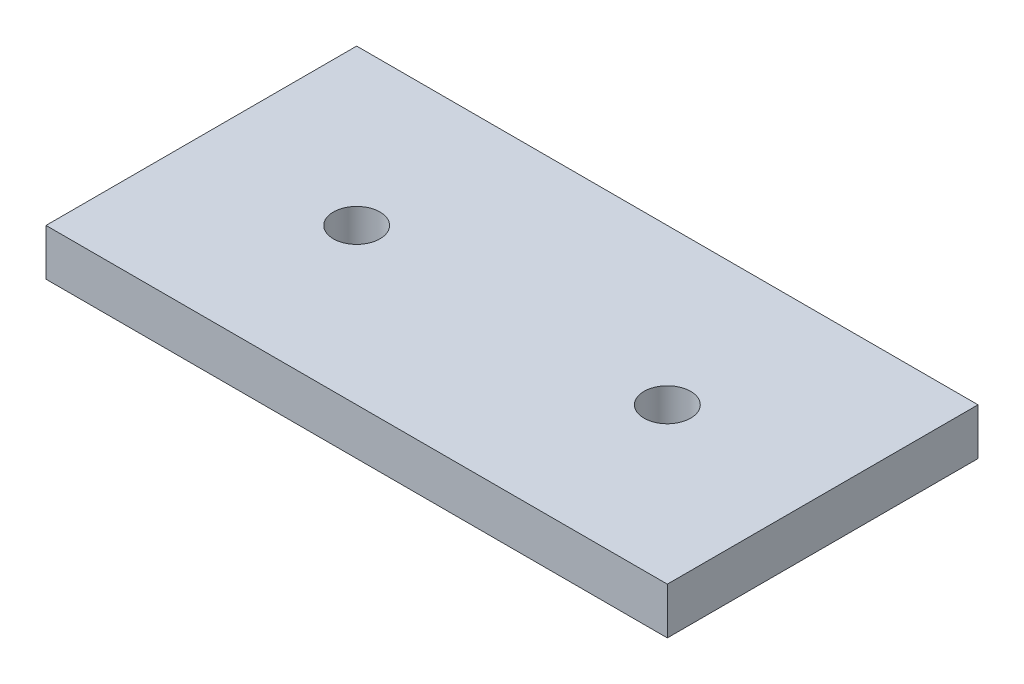
from build123d import *

# Parameters (mm, degrees)
SKETCH_1_W      = 40
SKETCH_1_H      = 20
SKETCH_1_R      = 1.5
EXTRUDE_1_DEPTH = 3


with BuildPart() as part:
    # 草图1 → 凸台-拉伸1 (new body)
    with BuildSketch(Plane(origin=(0, 0, 0), x_dir=(1, 0, 0), z_dir=(0, 1, 0))):
        Rectangle(SKETCH_1_W, SKETCH_1_H)
        with Locations(Location((-10, 0, 0), (0, 0, 270))):
            Circle(SKETCH_1_R, mode=Mode.SUBTRACT)
        with Locations(Location((10, 0, 0), (0, 0, 270))):
            Circle(SKETCH_1_R, mode=Mode.SUBTRACT)
    extrude(amount=EXTRUDE_1_DEPTH)


solid = part.part
